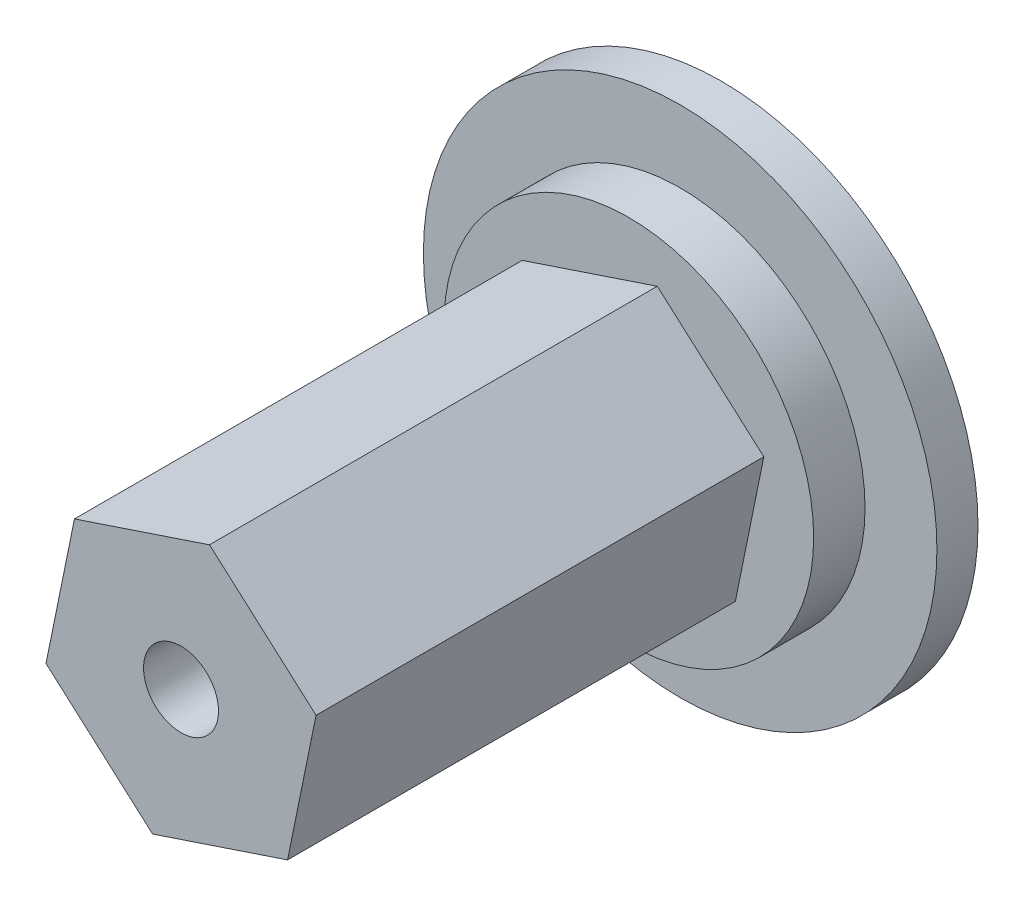
from build123d import *

# Parameters (mm, degrees)
SKETCH_1_R          = 12.5
EXTRUDE_1_DEPTH     = 2
SKETCH_2_R          = 9
EXTRUDE_2_DEPTH     = 2.5
EXTRUDE_3_DEPTH     = 21.8
SKETCH_4_R          = 1.825
CUT_EXTRUDE_1_DEPTH = 32.688957067
SKETCH_5_R          = 6.25
CUT_EXTRUDE_2_DEPTH = 2


with BuildPart() as part:
    # 草图1 → 凸台-拉伸1 (new body)
    with BuildSketch(Plane.XY):
        Circle(SKETCH_1_R)
    extrude(amount=EXTRUDE_1_DEPTH)

    # 草图2 → 凸台-拉伸2 (add)
    with BuildSketch(Plane.XY.offset(2)):
        Circle(SKETCH_2_R)
    extrude(amount=EXTRUDE_2_DEPTH)

    # 草图3 → 凸台-拉伸3 (add)
    with BuildSketch(Plane.XY.offset(4.5)):
        Polygon((5.187426457, -4.595161232), (6.57323959, 2.194862476), (1.385813133, 6.790023708), (-5.187426457, 4.595161232), (-6.57323959, -2.194862476), (-1.385813133, -6.790023708), align=None)
    extrude(amount=EXTRUDE_3_DEPTH)

    # 草图4 → 切除-拉伸1 (cut, through all)
    with BuildSketch(Plane.XY.offset(26.3)):
        Circle(SKETCH_4_R)
    extrude(amount=-CUT_EXTRUDE_1_DEPTH, mode=Mode.SUBTRACT)

    # 草图5 → 切除-拉伸2 (cut)
    with BuildSketch(Plane(origin=(0, 0, 0), x_dir=(-1, 0, 0), z_dir=(0, 0, -1))):
        Circle(SKETCH_5_R)
    extrude(amount=-CUT_EXTRUDE_2_DEPTH, mode=Mode.SUBTRACT)


solid = part.part
